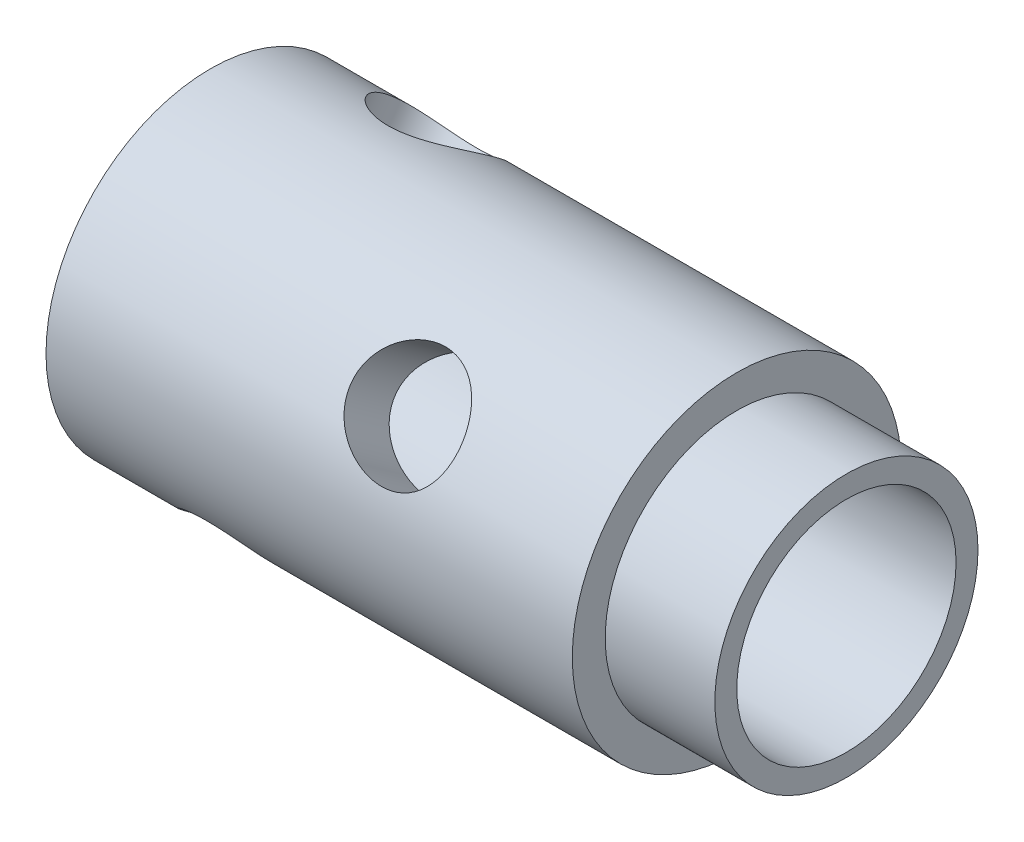
from build123d import *

# Parameters (mm, degrees)
CUT_EXTRUDE1_DEPTH      = 195.978637362
CUT_EXTRUDE1_DEPTH_BACK = 195.978637362
SKETCH4_R               = 2.5
CUT_EXTRUDE2_DEPTH      = 151.611328634
CUT_EXTRUDE2_DEPTH_BACK = 151.611328634
SKETCH3_R               = 2.5


with BuildPart() as part:
    # Sketch2 → Revolve1 (revolve)
    with BuildSketch(Plane.XY, mode=Mode.PRIVATE) as revolve1_sk:
        Polygon((0, 6), (-5, 6), (-5, 7.5), (-29, 7.5), (-29, 5), (0, 5), align=None)
    revolve(revolve1_sk.sketch.rotate(Axis((0, 0, 0), (-1, 0, 0)), 90), axis=Axis((0, 0, 0), (-1, 0, 0)))

    # Sketch4 → Cut-Extrude1 (cut, two sides: drawn at the far end of the back side and taken through both)
    with BuildSketch(Plane(origin=(-120.750059673, 87.243462265, 112.748777435), x_dir=(0.8561890359823346, 0.3016571585603837, 0.41945594924010343), z_dir=(0, 0.8118564738851006, -0.5838570593996881)).offset(-CUT_EXTRUDE1_DEPTH_BACK)):
        with Locations(Location((10.081768965, 172.488088347, 0), (0, 0, 301.108656356))):
            Circle(SKETCH4_R)
    extrude(amount=CUT_EXTRUDE1_DEPTH + CUT_EXTRUDE1_DEPTH_BACK, mode=Mode.SUBTRACT)

    # Sketch3 → Cut-Extrude2 (cut, two sides: drawn at the far end of the back side and taken through both)
    with BuildSketch(Plane(origin=(-120.750059673, -67.453558659, 42.35137307), x_dir=(-0.5093963915480642, 0.6986284720029967, -0.5024276807507421), z_dir=(0, -0.5838570593996879, -0.8118564738851008)).offset(-CUT_EXTRUDE2_DEPTH_BACK)):
        with Locations(Location((14.02538357, 132.353637021, 0), (0, 0, 30.623632048))):
            Circle(SKETCH3_R)
    extrude(amount=CUT_EXTRUDE2_DEPTH + CUT_EXTRUDE2_DEPTH_BACK, mode=Mode.SUBTRACT)


solid = part.part
